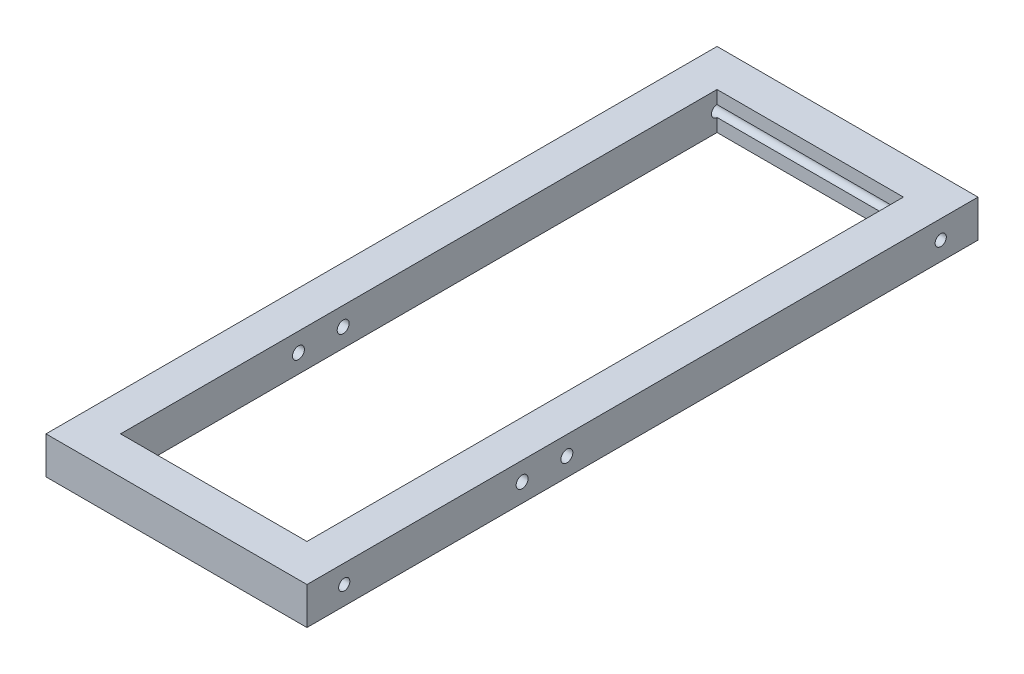
from build123d import *

# Parameters (mm, degrees)
CROQUIS1_W                   = 70
CROQUIS1_H                   = 180
CROQUIS1_W_2                 = 50
CROQUIS1_H_2                 = 160
SALIENTE_EXTRUIR1_DEPTH      = 5
CROQUIS2_R                   = 1.5
CORTAR_EXTRUIR1_DEPTH        = 60
TALADRO_DE_MARGEN_PARA_M31_D = 3.2


with BuildPart() as part:
    # Croquis1 → Saliente-Extruir1 (new, symmetric)
    with BuildSketch(Plane(origin=(0, 0, 0), x_dir=(1, 0, 0), z_dir=(0, 1, 0))):
        Rectangle(CROQUIS1_W, CROQUIS1_H)
        Rectangle(CROQUIS1_W_2, CROQUIS1_H_2, mode=Mode.SUBTRACT)
    extrude(amount=SALIENTE_EXTRUIR1_DEPTH, both=True)

    # Croquis2 → Cortar-Extruir1 (cut, symmetric)
    with BuildSketch(Plane(origin=(0, 0, 0), x_dir=(0, 0, -1), z_dir=(1, 0, 0))):
        with Locations((-80, 0)):
            Circle(CROQUIS2_R)
        with Locations((80, 0)):
            Circle(CROQUIS2_R)
    extrude(amount=CORTAR_EXTRUIR1_DEPTH, both=True, mode=Mode.SUBTRACT)

    # Taladro de margen para M31 (through all)
    with Locations(Plane(origin=(-35, -0.010928271, 32.287523851), x_dir=(0, 0, -1), z_dir=(-1, 0, 0))):
        with Locations((0, 0), (12.001709214, -0.007929279)):
            Hole(TALADRO_DE_MARGEN_PARA_M31_D / 2)


solid = part.part
